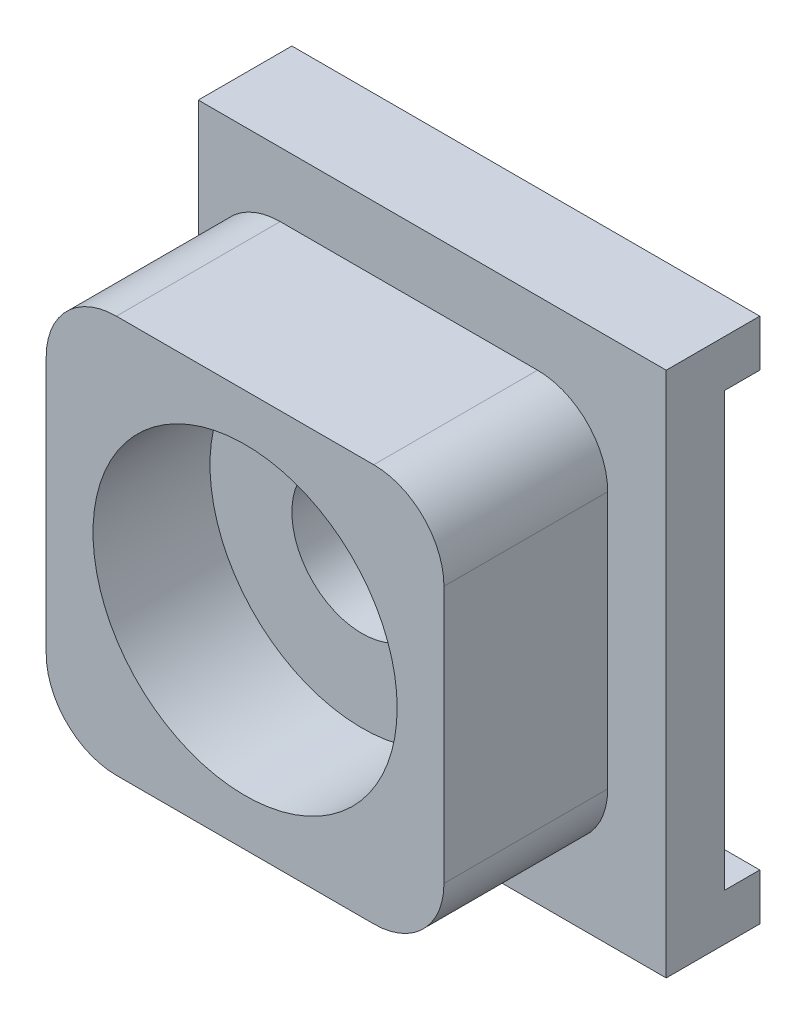
from build123d import *

# Parameters (mm, degrees)
BOSS_EXTRUDE1_DEPTH = 20
SKETCH2_R           = 3
CUT_EXTRUDE1_DEPTH  = 3
BOSS_EXTRUDE2_START = 7
SKETCH3_W           = 17
SKETCH3_H           = 17
SKETCH3_R           = 3
BOSS_EXTRUDE2_DEPTH = 7
SKETCH4_R           = 6.5
CUT_EXTRUDE2_DEPTH  = 5
FILLET1_R           = 3


with BuildPart() as part:
    # Sketch1 → Boss-Extrude1 (new body)
    with BuildSketch(Plane(origin=(0, 0, 0), x_dir=(0, 0, -1), z_dir=(1, 0, 0))):
        Polygon((2.785388085, -22.866116346), (4.285388085, -22.866116346), (4.285388085, -20.866116346), (0.285388085, -20.866116346), (0.285388085, -43.366116346), (4.285388085, -43.366116346), (4.285388085, -41.366116346), (2.785388085, -41.366116346), align=None)
    extrude(amount=BOSS_EXTRUDE1_DEPTH)

    # Sketch2 → Cut-Extrude1 (cut)
    with BuildSketch(Plane.XY.offset(-0.285388085)):
        with Locations((9, -32.116116346)):
            Circle(SKETCH2_R)
    extrude(amount=-CUT_EXTRUDE1_DEPTH, mode=Mode.SUBTRACT)

    # Sketch3 → Boss-Extrude2 (add)
    with BuildSketch(Plane.XY.offset(-0.285388085).offset(BOSS_EXTRUDE2_START)):
        with Locations((9, -32.116116346)):
            Rectangle(SKETCH3_W, SKETCH3_H)
        with Locations((9, -32.116116346)):
            Circle(SKETCH3_R, mode=Mode.SUBTRACT)
    extrude(amount=-BOSS_EXTRUDE2_DEPTH)

    # Sketch4 → Cut-Extrude2 (cut)
    with BuildSketch(Plane.XY.offset(6.714611915)):
        with Locations((9, -32.116116346)):
            Circle(SKETCH4_R)
    extrude(amount=-CUT_EXTRUDE2_DEPTH, mode=Mode.SUBTRACT)

    # Fillet1
    fillet1_edges = [part.edges().sort_by_distance(p)[0] for p in [
        (0.5, -23.616116346, 3.214611915),
        (0.5, -40.616116346, 3.214611915),
        (17.5, -40.616116346, 3.214611915),
        (17.5, -23.616116346, 3.214611915),
    ]]
    fillet(fillet1_edges, radius=FILLET1_R)


solid = part.part
